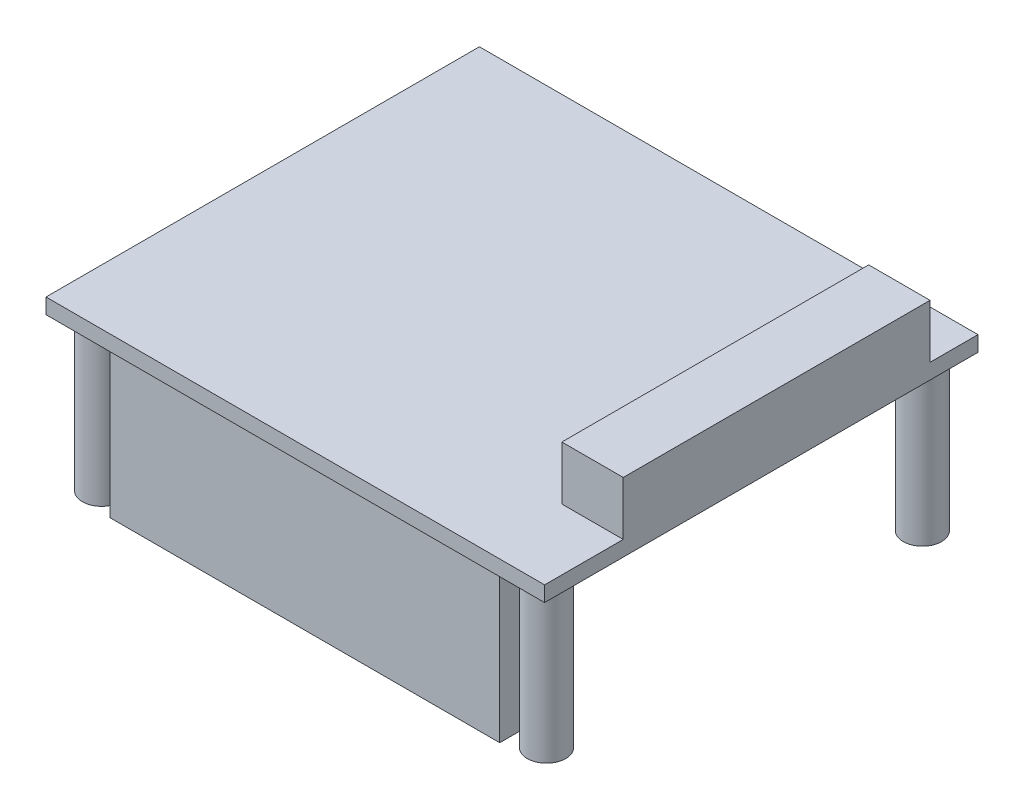
from build123d import *

# Parameters (mm, degrees)
SK_P01_STANDOFF_R                  = 2.5
P01_STANDOFF_DEPTH                 = 20
SK_P02_STANDOFF_R                  = 2.5
P02_STANDOFF_DEPTH                 = 20
SK_P03_STANDOFF_R                  = 2.5
P03_STANDOFF_DEPTH                 = 20
SK_P04_STANDOFF_R                  = 2.5
P04_STANDOFF_DEPTH                 = 20
P05_PERMAPROTOHAT35MMFANCUTO_START = 20
SK_P05_PERMAPROTOHAT35MMFANCUTO_W  = 65
SK_P05_PERMAPROTOHAT35MMFANCUTO_H  = 56.5
P05_PERMAPROTOHAT35MMFANCUTO_DEPTH = 2
SK_P06_STACKINGHEADER_W            = 50.8
SK_P06_STACKINGHEADER_H            = 5
P06_STACKINGHEADER_DEPTH           = 20
P07_JSTXHHEADERSVERTICAL_START     = 22
SK_P07_JSTXHHEADERSVERTICAL_W      = 8
SK_P07_JSTXHHEADERSVERTICAL_H      = 40
P07_JSTXHHEADERSVERTICAL_DEPTH     = 7


with BuildPart() as part:
    # SK_P01_Standoff → P01_Standoff (new body)
    with BuildSketch(Plane(origin=(0, 0, 0), x_dir=(1, 0, 0), z_dir=(0, 1, 0))):
        with Locations(Location((-29, 24.5, 0), (0, 0, 270))):
            Circle(SK_P01_STANDOFF_R)
    extrude(amount=P01_STANDOFF_DEPTH)



with BuildPart() as body_2:
    # SK_P02_Standoff → P02_Standoff (new body)
    with BuildSketch(Plane(origin=(0, 0, 0), x_dir=(1, 0, 0), z_dir=(0, 1, 0))):
        with Locations(Location((-29, -24.5, 0), (0, 0, 270))):
            Circle(SK_P02_STANDOFF_R)
    extrude(amount=P02_STANDOFF_DEPTH)


with BuildPart() as body_3:
    # SK_P03_Standoff → P03_Standoff (new body)
    with BuildSketch(Plane(origin=(0, 0, 0), x_dir=(1, 0, 0), z_dir=(0, 1, 0))):
        with Locations(Location((29, 24.5, 0), (0, 0, 270))):
            Circle(SK_P03_STANDOFF_R)
    extrude(amount=P03_STANDOFF_DEPTH)


with BuildPart() as body_4:
    # SK_P04_Standoff → P04_Standoff (new body)
    with BuildSketch(Plane(origin=(0, 0, 0), x_dir=(1, 0, 0), z_dir=(0, 1, 0))):
        with Locations(Location((29, -24.5, 0), (0, 0, 270))):
            Circle(SK_P04_STANDOFF_R)
    extrude(amount=P04_STANDOFF_DEPTH)


with BuildPart() as part_1:
    add(part.part)

    add(body_2.part)  # P05_PermaProtoHAT35mmfancuto merges body 2

    add(body_3.part)  # P05_PermaProtoHAT35mmfancuto merges body 3

    add(body_4.part)  # P05_PermaProtoHAT35mmfancuto merges body 4
    # SK_P05_PermaProtoHAT35mmfancuto → P05_PermaProtoHAT35mmfancuto (add)
    with BuildSketch(Plane(origin=(0, 0, 0), x_dir=(1, 0, 0), z_dir=(0, 1, 0)).offset(P05_PERMAPROTOHAT35MMFANCUTO_START)):
        Rectangle(SK_P05_PERMAPROTOHAT35MMFANCUTO_W, SK_P05_PERMAPROTOHAT35MMFANCUTO_H)
    extrude(amount=P05_PERMAPROTOHAT35MMFANCUTO_DEPTH)

    # SK_P06_Stackingheader → P06_Stackingheader (add)
    with BuildSketch(Plane(origin=(0, 0, 0), x_dir=(1, 0, 0), z_dir=(0, 1, 0))):
        with Locations((0, -24.5)):
            Rectangle(SK_P06_STACKINGHEADER_W, SK_P06_STACKINGHEADER_H)
    extrude(amount=P06_STACKINGHEADER_DEPTH)

    # SK_P07_JSTXHheadersvertical → P07_JSTXHheadersvertical (add)
    with BuildSketch(Plane(origin=(0, 0, 0), x_dir=(1, 0, 0), z_dir=(0, 1, 0)).offset(P07_JSTXHHEADERSVERTICAL_START)):
        with Locations((28.5, 2)):
            Rectangle(SK_P07_JSTXHHEADERSVERTICAL_W, SK_P07_JSTXHHEADERSVERTICAL_H)
    extrude(amount=P07_JSTXHHEADERSVERTICAL_DEPTH)


solid = part_1.part
